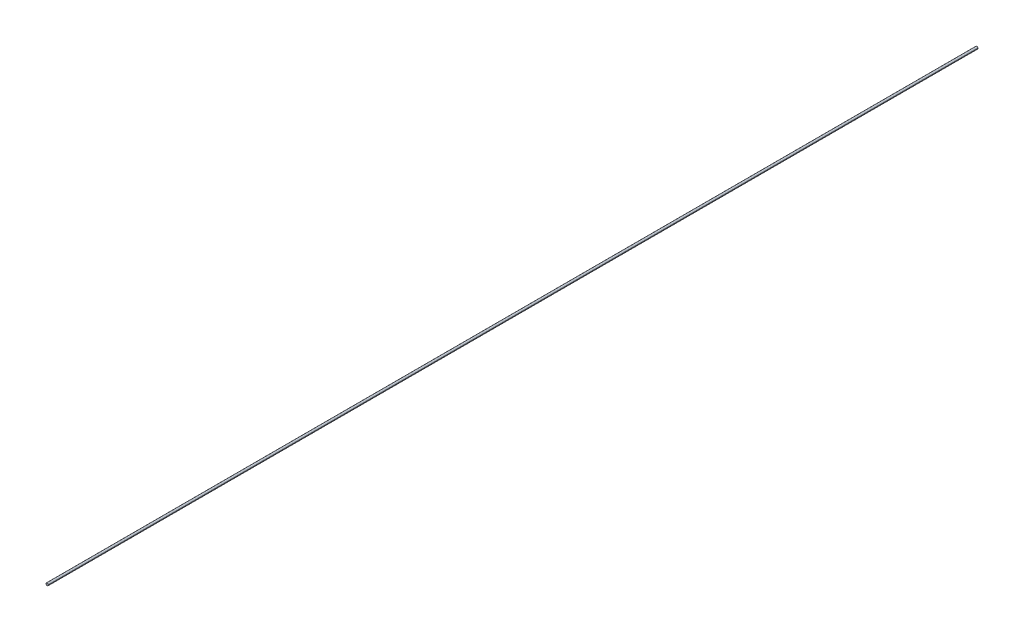
from build123d import *

# Parameters (mm, degrees)
CROQUIS1_R              = 19.05
SALIENTE_EXTRUIR1_DEPTH = 15000
CROQUIS2_W              = 0.59220922
CROQUIS2_H              = 0.552153
SALIENTE_EXTRUIR2_DEPTH = 15000
CROQUIS3_W              = 0.53526764
CROQUIS3_H              = 0.552153
SALIENTE_EXTRUIR3_DEPTH = 15000


with BuildPart() as part:
    # Croquis1 → Saliente-Extruir1 (new body)
    with BuildSketch(Plane.XY):
        Circle(CROQUIS1_R)
    extrude(amount=SALIENTE_EXTRUIR1_DEPTH)

    # Croquis2 → Saliente-Extruir2 (add)
    with BuildSketch(Plane(origin=(0, 0, 0), x_dir=(-1, 0, 0), z_dir=(0, 0, -1))):
        with Locations((-19.05, 0)):
            Rectangle(CROQUIS2_W, CROQUIS2_H)
    extrude(amount=-SALIENTE_EXTRUIR2_DEPTH)

    # Croquis3 → Saliente-Extruir3 (add)
    with BuildSketch(Plane(origin=(0, 0, 0), x_dir=(-1, 0, 0), z_dir=(0, 0, -1))):
        with Locations((19.05, 0)):
            Rectangle(CROQUIS3_W, CROQUIS3_H)
    extrude(amount=-SALIENTE_EXTRUIR3_DEPTH)


solid = part.part
